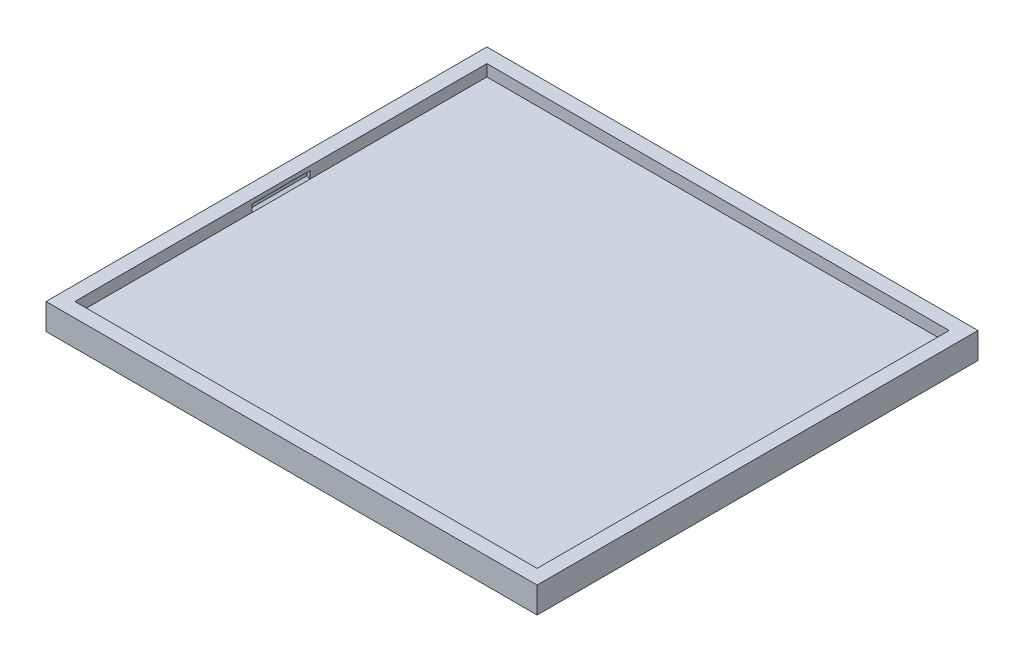
from build123d import *

# Parameters (mm, degrees)
SKETCH2_W           = 216
SKETCH2_H           = 193.902
SKETCH2_W_2         = 203.3
SKETCH2_H_2         = 181.202
BOSS_EXTRUDE1_DEPTH = 12.7
SKETCH2_3_W         = 203.3
SKETCH2_3_H         = 181.202
BOSS_EXTRUDE2_DEPTH = 6.35
CUT_EXTRUDE1_DEPTH  = 12.7
SKETCH5_W           = 216
SKETCH5_H           = 193.902
CUT_EXTRUDE2_DEPTH  = 1.27


with BuildPart() as part:
    # Sketch2 → Boss-Extrude1 (new body)
    with BuildSketch(Plane(origin=(0, 0, 0), x_dir=(1, 0, 0), z_dir=(0, 1, 0))):
        with Locations((101.6, 90.551)):
            Rectangle(SKETCH2_W, SKETCH2_H)
        with Locations((101.6, 90.551)):
            Rectangle(SKETCH2_W_2, SKETCH2_H_2, mode=Mode.SUBTRACT)
    extrude(amount=BOSS_EXTRUDE1_DEPTH)

    # Sketch2<3> → Boss-Extrude2 (add)
    with BuildSketch(Plane(origin=(0, 0, 0), x_dir=(1, 0, 0), z_dir=(0, 1, 0))):
        with Locations((101.6, 90.551)):
            Rectangle(SKETCH2_3_W, SKETCH2_3_H)
    extrude(amount=BOSS_EXTRUDE2_DEPTH)

    # Sketch4 → Cut-Extrude1 (cut, symmetric)
    with BuildSketch(Plane(origin=(0, 0, -90.551), x_dir=(-1, 0, 0), z_dir=(0, 0, -1))):
        Polygon((-203.2, 9.645710678), (-204.507721606, 8.337989072), (-204.507721606, 7.018410881), (-203.2, 6.26339746), align=None)
    cut_extrude1 = extrude(amount=CUT_EXTRUDE1_DEPTH, both=True, mode=Mode.SUBTRACT)

    # Sketch5 → Cut-Extrude2 (cut)
    with BuildSketch(Plane(origin=(0, 12.7, 0), x_dir=(1, 0, 0), z_dir=(0, 1, 0))):
        with Locations((101.6, 90.551)):
            Rectangle(SKETCH5_W, SKETCH5_H)
        Polygon((203.2, 77.851), (203.2, 103.251), (203.25, 103.251), (203.25, 181.152), (-0.05, 181.152), (-0.05, -0.05), (203.25, -0.05), (203.25, 77.851), align=None, mode=Mode.SUBTRACT)
    extrude(amount=-CUT_EXTRUDE2_DEPTH, mode=Mode.SUBTRACT)

    # Mirror1: Cut-Extrude1 across plane
    add(cut_extrude1.mirror(Plane.ZY.offset(-101.6)), mode=Mode.SUBTRACT)


solid = part.part
